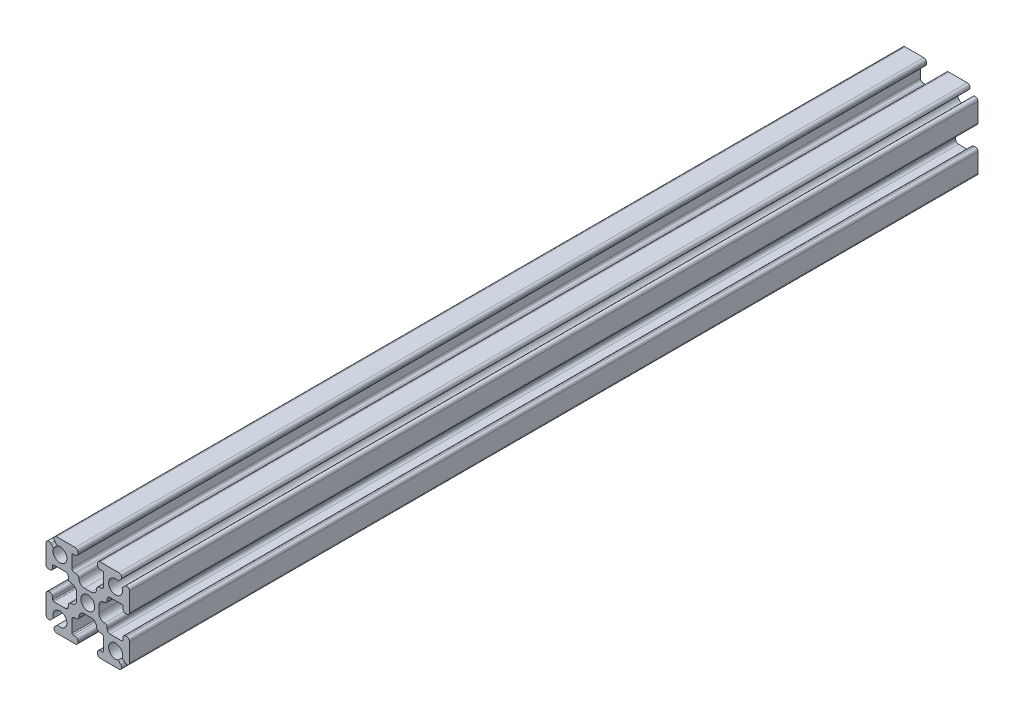
from build123d import *

# Parameters (mm, degrees)
SKETCH1_R           = 1.25
BOSS_EXTRUDE1_DEPTH = 152.4


with BuildPart() as part:
    # Sketch1 → Boss-Extrude1 (new body)
    with BuildSketch(Plane.XY):
        with BuildLine():
            Line((6.646446609, 5.939339828), (6.163645978, 5.456539197))
            ThreePointArc((6.163645978, 5.456539197), (4.116116524, 4.116116524), (5.456539197, 6.163645978))
            Line((5.456539197, 6.163645978), (5.939339828, 6.646446609))
            ThreePointArc((5.939339828, 6.646446609), (6.047726204, 7.191341716), (5.585786438, 7.5))
            Line((5.585786438, 7.5), (2.25, 7.5))
            ThreePointArc((2.25, 7.5), (1.896446609, 7.353553391), (1.75, 7))
            Line((1.75, 7), (1.75, 6.8))
            ThreePointArc((1.75, 6.8), (1.896446609, 6.446446609), (2.25, 6.3))
            Line((2.25, 6.3), (2.65, 6.3))
            ThreePointArc((2.65, 6.3), (2.791421356, 6.241421356), (2.85, 6.1))
            Line((2.85, 6.1), (2.85, 4))
            ThreePointArc((2.85, 4), (2.703553391, 3.646446609), (2.35, 3.5))
            Line((2.35, 3.5), (2.1, 3.5))
            ThreePointArc((2.1, 3.5), (1.746446609, 3.353553391), (1.6, 3))
            ThreePointArc((1.6, 3), (1.307106781, 2.292893219), (0.6, 2))
            Line((0.6, 2), (-0.6, 2))
            ThreePointArc((-0.6, 2), (-1.307106781, 2.292893219), (-1.6, 3))
            ThreePointArc((-1.6, 3), (-1.746446609, 3.353553391), (-2.1, 3.5))
            Line((-2.1, 3.5), (-2.35, 3.5))
            ThreePointArc((-2.35, 3.5), (-2.703553391, 3.646446609), (-2.85, 4))
            Line((-2.85, 4), (-2.85, 6.1))
            ThreePointArc((-2.85, 6.1), (-2.791421356, 6.241421356), (-2.65, 6.3))
            Line((-2.65, 6.3), (-2.25, 6.3))
            ThreePointArc((-2.25, 6.3), (-1.896446609, 6.446446609), (-1.75, 6.8))
            Line((-1.75, 6.8), (-1.75, 7))
            ThreePointArc((-1.75, 7), (-1.896446609, 7.353553391), (-2.25, 7.5))
            Line((-2.25, 7.5), (-5.585786438, 7.5))
            ThreePointArc((-5.585786438, 7.5), (-6.047726204, 7.191341716), (-5.939339828, 6.646446609))
            Line((-5.939339828, 6.646446609), (-5.456539197, 6.163645978))
            ThreePointArc((-5.456539197, 6.163645978), (-4.116116524, 4.116116524), (-6.163645978, 5.456539197))
            Line((-6.163645978, 5.456539197), (-6.646446609, 5.939339828))
            ThreePointArc((-6.646446609, 5.939339828), (-7.191341716, 6.047726204), (-7.5, 5.585786438))
            Line((-7.5, 5.585786438), (-7.5, 2.25))
            ThreePointArc((-7.5, 2.25), (-7.353553391, 1.896446609), (-7, 1.75))
            Line((-7, 1.75), (-6.8, 1.75))
            ThreePointArc((-6.8, 1.75), (-6.446446609, 1.896446609), (-6.3, 2.25))
            Line((-6.3, 2.25), (-6.3, 2.65))
            ThreePointArc((-6.3, 2.65), (-6.241421356, 2.791421356), (-6.1, 2.85))
            Line((-6.1, 2.85), (-4, 2.85))
            ThreePointArc((-4, 2.85), (-3.646446609, 2.703553391), (-3.5, 2.35))
            Line((-3.5, 2.35), (-3.5, 2.1))
            ThreePointArc((-3.5, 2.1), (-3.353553391, 1.746446609), (-3, 1.6))
            ThreePointArc((-3, 1.6), (-2.292893219, 1.307106781), (-2, 0.6))
            Line((-2, 0.6), (-2, -0.6))
            ThreePointArc((-2, -0.6), (-2.292893219, -1.307106781), (-3, -1.6))
            ThreePointArc((-3, -1.6), (-3.353553391, -1.746446609), (-3.5, -2.1))
            Line((-3.5, -2.1), (-3.5, -2.35))
            ThreePointArc((-3.5, -2.35), (-3.646446609, -2.703553391), (-4, -2.85))
            Line((-4, -2.85), (-6.1, -2.85))
            ThreePointArc((-6.1, -2.85), (-6.241421356, -2.791421356), (-6.3, -2.65))
            Line((-6.3, -2.65), (-6.3, -2.25))
            ThreePointArc((-6.3, -2.25), (-6.446446609, -1.896446609), (-6.8, -1.75))
            Line((-6.8, -1.75), (-7, -1.75))
            ThreePointArc((-7, -1.75), (-7.353553391, -1.896446609), (-7.5, -2.25))
            Line((-7.5, -2.25), (-7.5, -5.585786438))
            ThreePointArc((-7.5, -5.585786438), (-7.191341716, -6.047726204), (-6.646446609, -5.939339828))
            Line((-6.646446609, -5.939339828), (-6.163645978, -5.456539197))
            ThreePointArc((-6.163645978, -5.456539197), (-4.116116524, -4.116116524), (-5.456539197, -6.163645978))
            Line((-5.456539197, -6.163645978), (-5.939339828, -6.646446609))
            ThreePointArc((-5.939339828, -6.646446609), (-6.047726204, -7.191341716), (-5.585786438, -7.5))
            Line((-5.585786438, -7.5), (-2.25, -7.5))
            ThreePointArc((-2.25, -7.5), (-1.896446609, -7.353553391), (-1.75, -7))
            Line((-1.75, -7), (-1.75, -6.8))
            ThreePointArc((-1.75, -6.8), (-1.896446609, -6.446446609), (-2.25, -6.3))
            Line((-2.25, -6.3), (-2.65, -6.3))
            ThreePointArc((-2.65, -6.3), (-2.791421356, -6.241421356), (-2.85, -6.1))
            Line((-2.85, -6.1), (-2.85, -4))
            ThreePointArc((-2.85, -4), (-2.703553391, -3.646446609), (-2.35, -3.5))
            Line((-2.35, -3.5), (-2.1, -3.5))
            ThreePointArc((-2.1, -3.5), (-1.746446609, -3.353553391), (-1.6, -3))
            ThreePointArc((-1.6, -3), (-1.307106781, -2.292893219), (-0.6, -2))
            Line((-0.6, -2), (0.6, -2))
            ThreePointArc((0.6, -2), (1.307106781, -2.292893219), (1.6, -3))
            ThreePointArc((1.6, -3), (1.746446609, -3.353553391), (2.1, -3.5))
            Line((2.1, -3.5), (2.35, -3.5))
            ThreePointArc((2.35, -3.5), (2.703553391, -3.646446609), (2.85, -4))
            Line((2.85, -4), (2.85, -6.1))
            ThreePointArc((2.85, -6.1), (2.791421356, -6.241421356), (2.65, -6.3))
            Line((2.65, -6.3), (2.25, -6.3))
            ThreePointArc((2.25, -6.3), (1.896446609, -6.446446609), (1.75, -6.8))
            Line((1.75, -6.8), (1.75, -7))
            ThreePointArc((1.75, -7), (1.896446609, -7.353553391), (2.25, -7.5))
            Line((2.25, -7.5), (5.585786438, -7.5))
            ThreePointArc((5.585786438, -7.5), (6.047726204, -7.191341716), (5.939339828, -6.646446609))
            Line((5.939339828, -6.646446609), (5.456539197, -6.163645978))
            ThreePointArc((5.456539197, -6.163645978), (4.116116524, -4.116116524), (6.163645978, -5.456539197))
            Line((6.163645978, -5.456539197), (6.646446609, -5.939339828))
            ThreePointArc((6.646446609, -5.939339828), (7.191341716, -6.047726204), (7.5, -5.585786438))
            Line((7.5, -5.585786438), (7.5, -2.25))
            ThreePointArc((7.5, -2.25), (7.353553391, -1.896446609), (7, -1.75))
            Line((7, -1.75), (6.8, -1.75))
            ThreePointArc((6.8, -1.75), (6.446446609, -1.896446609), (6.3, -2.25))
            Line((6.3, -2.25), (6.3, -2.65))
            ThreePointArc((6.3, -2.65), (6.241421356, -2.791421356), (6.1, -2.85))
            Line((6.1, -2.85), (4, -2.85))
            ThreePointArc((4, -2.85), (3.646446609, -2.703553391), (3.5, -2.35))
            Line((3.5, -2.35), (3.5, -2.1))
            ThreePointArc((3.5, -2.1), (3.353553391, -1.746446609), (3, -1.6))
            ThreePointArc((3, -1.6), (2.292893219, -1.307106781), (2, -0.6))
            Line((2, -0.6), (2, 0.6))
            ThreePointArc((2, 0.6), (2.292893219, 1.307106781), (3, 1.6))
            ThreePointArc((3, 1.6), (3.353553391, 1.746446609), (3.5, 2.1))
            Line((3.5, 2.1), (3.5, 2.35))
            ThreePointArc((3.5, 2.35), (3.646446609, 2.703553391), (4, 2.85))
            Line((4, 2.85), (6.1, 2.85))
            ThreePointArc((6.1, 2.85), (6.241421356, 2.791421356), (6.3, 2.65))
            Line((6.3, 2.65), (6.3, 2.25))
            ThreePointArc((6.3, 2.25), (6.446446609, 1.896446609), (6.8, 1.75))
            Line((6.8, 1.75), (7, 1.75))
            ThreePointArc((7, 1.75), (7.353553391, 1.896446609), (7.5, 2.25))
            Line((7.5, 2.25), (7.5, 5.585786438))
            ThreePointArc((7.5, 5.585786438), (7.191341716, 6.047726204), (6.646446609, 5.939339828))
        make_face()
        with Locations(Location((0, 0, 0), (0, 0, 180))):
            Circle(SKETCH1_R, mode=Mode.SUBTRACT)
    extrude(amount=BOSS_EXTRUDE1_DEPTH)


solid = part.part
